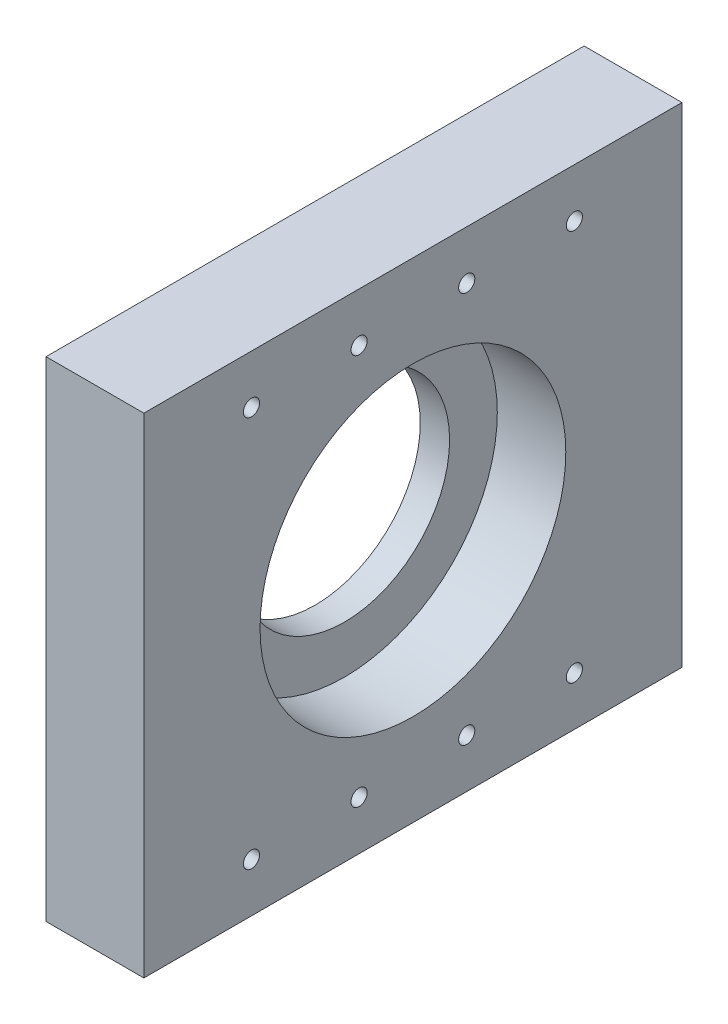
from build123d import *

# Parameters (mm, degrees)
SKETCH_1_W          = 110
SKETCH_1_H          = 100
EXTRUDE_1_DEPTH     = 20
SKETCH_2_R          = 31.25
CUT_EXTRUDE_1_DEPTH = 14
SKETCH_3_R          = 21.5
CUT_EXTRUDE_2_DEPTH = 14
SKETCH_4_R          = 1.65
CUT_EXTRUDE_3_DEPTH = 77.974021592


with BuildPart() as part:
    # 草图1 → 凸台-拉伸1 (new body)
    with BuildSketch(Plane(origin=(0, 0, 0), x_dir=(0, 0, -1), z_dir=(1, 0, 0))):
        Rectangle(SKETCH_1_W, SKETCH_1_H)
    extrude(amount=EXTRUDE_1_DEPTH)

    # 草图2 → 切除-拉伸1 (cut)
    with BuildSketch(Plane(origin=(20, 0, 0), x_dir=(0, 0, -1), z_dir=(1, 0, 0))):
        Circle(SKETCH_2_R)
    extrude(amount=-CUT_EXTRUDE_1_DEPTH, mode=Mode.SUBTRACT)

    # 草图3 → 切除-拉伸2 (cut)
    with BuildSketch(Plane(origin=(6, 0, 0), x_dir=(0, 0, -1), z_dir=(1, 0, 0))):
        Circle(SKETCH_3_R)
    extrude(amount=-CUT_EXTRUDE_2_DEPTH, mode=Mode.SUBTRACT)

    # 草图4 → 切除-拉伸3 (cut, through all)
    with BuildSketch(Plane(origin=(20, 0, 0), x_dir=(0, 0, -1), z_dir=(1, 0, 0))):
        with Locations((33, 40)):
            Circle(SKETCH_4_R)
        with Locations((11, 40)):
            Circle(SKETCH_4_R)
        with Locations((-11, 40)):
            Circle(SKETCH_4_R)
        with Locations((-33, 40)):
            Circle(SKETCH_4_R)
        with Locations(Location((-11, -40, 0), (0, 0, 180))):
            Circle(SKETCH_4_R)
        with Locations(Location((11, -40, 0), (0, 0, 180))):
            Circle(SKETCH_4_R)
        with Locations(Location((33, -40, 0), (0, 0, 180))):
            Circle(SKETCH_4_R)
        with Locations(Location((-33, -40, 0), (0, 0, 180))):
            Circle(SKETCH_4_R)
    extrude(amount=-CUT_EXTRUDE_3_DEPTH, mode=Mode.SUBTRACT)


solid = part.part
